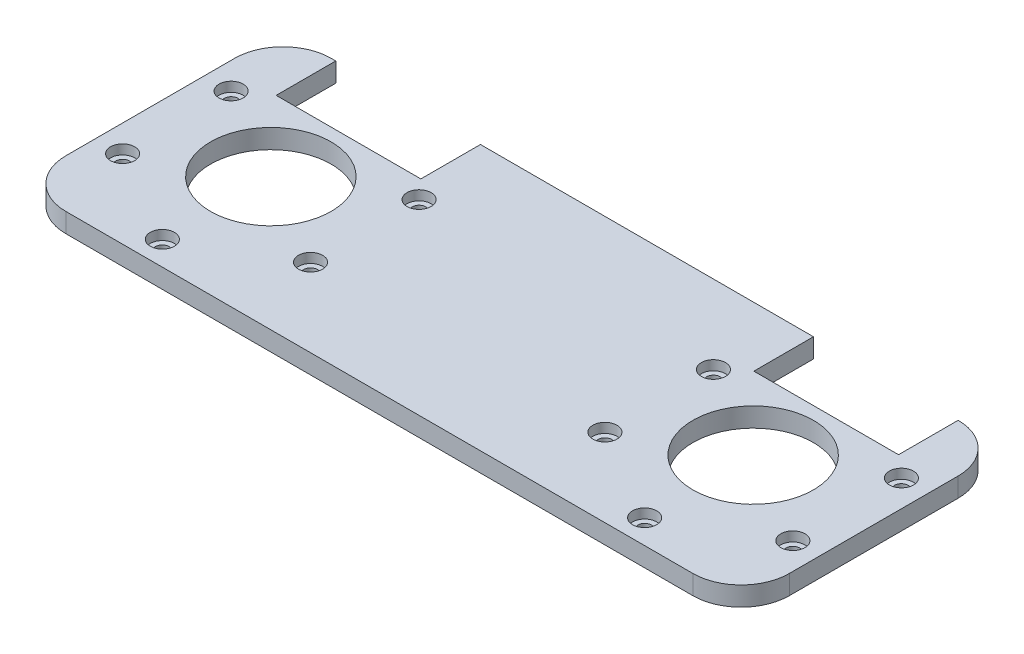
from build123d import *

# Parameters (mm, degrees)
SKETCH1_W           = 150
SKETCH1_H           = 55
SKETCH1_R           = 12.5
BOSS_EXTRUDE1_DEPTH = 4
SKETCH2_R           = 1.4
CUT_EXTRUDE1_DEPTH  = 80.982810653
SKETCH3_R           = 2.5
CUT_EXTRUDE3_DEPTH  = 2
FILLET1_R           = 10
SKETCH4_W           = 30
SKETCH4_H           = 12.357308998
CUT_EXTRUDE4_DEPTH  = 80.982810653


with BuildPart() as part:
    # Sketch1 → Boss-Extrude1 (new body)
    with BuildSketch(Plane(origin=(0, 0, 0), x_dir=(1, 0, 0), z_dir=(0, 1, 0))):
        Rectangle(SKETCH1_W, SKETCH1_H)
        with Locations(Location((-50, 0, 0), (0, 0, 270))):
            Circle(SKETCH1_R, mode=Mode.SUBTRACT)
        with Locations(Location((50, 0, 0), (0, 0, 270))):
            Circle(SKETCH1_R, mode=Mode.SUBTRACT)
    extrude(amount=BOSS_EXTRUDE1_DEPTH)

    # Sketch2 → Cut-Extrude1 (cut, through all)
    with BuildSketch(Plane(origin=(0, 4, 0), x_dir=(1, 0, 0), z_dir=(0, 1, 0))):
        with Locations(Location((30.514428415, 11.25, 0), (0, 0, 270))):
            Circle(SKETCH2_R)
        with Locations(Location((69.485571585, 11.25, 0), (0, 0, 270))):
            Circle(SKETCH2_R)
        with Locations(Location((69.485571585, -11.25, 0), (0, 0, 270))):
            Circle(SKETCH2_R)
        with Locations(Location((30.514428415, -11.25, 0), (0, 0, 270))):
            Circle(SKETCH2_R)
        with Locations(Location((50, -22.5, 0), (0, 0, 270))):
            Circle(SKETCH2_R)
    cut_extrude1 = extrude(amount=-CUT_EXTRUDE1_DEPTH, mode=Mode.SUBTRACT)

    # Sketch3 → Cut-Extrude3 (cut)
    with BuildSketch(Plane(origin=(0, 4, 0), x_dir=(1, 0, 0), z_dir=(0, 1, 0))):
        with Locations(Location((30.514428415, 11.25, 0), (0, 0, 270))):
            Circle(SKETCH3_R)
        with Locations(Location((30.514428415, -11.25, 0), (0, 0, 270))):
            Circle(SKETCH3_R)
        with Locations(Location((50, -22.5, 0), (0, 0, 270))):
            Circle(SKETCH3_R)
        with Locations(Location((69.485571585, -11.25, 0), (0, 0, 270))):
            Circle(SKETCH3_R)
        with Locations(Location((69.485571585, 11.25, 0), (0, 0, 270))):
            Circle(SKETCH3_R)
    cut_extrude3 = extrude(amount=-CUT_EXTRUDE3_DEPTH, mode=Mode.SUBTRACT)

    # Mirror1: Cut-Extrude1, Cut-Extrude3 across plane
    add(cut_extrude1.mirror(Plane(origin=(0, 0, 0), x_dir=(0, 0, 1), z_dir=(1, 0, 0))), mode=Mode.SUBTRACT)
    add(cut_extrude3.mirror(Plane(origin=(0, 0, 0), x_dir=(0, 0, 1), z_dir=(1, 0, 0))), mode=Mode.SUBTRACT)

    # Fillet1
    fillet1_edges = [part.edges().sort_by_distance(p)[0] for p in [
        (-75, 2, -27.5),
        (75, 2, -27.5),
        (75, 2, 27.5),
        (-75, 2, 27.5),
    ]]
    fillet(fillet1_edges, radius=FILLET1_R)

    # Sketch4 → Cut-Extrude4 (cut, through all)
    with BuildSketch(Plane.XZ):
        with Locations((-49.04071088, -21.321345501)):
            Rectangle(SKETCH4_W, SKETCH4_H)
        with Locations((50, -21.321345501)):
            Rectangle(SKETCH4_W, SKETCH4_H)
    extrude(amount=-CUT_EXTRUDE4_DEPTH, mode=Mode.SUBTRACT)


solid = part.part
